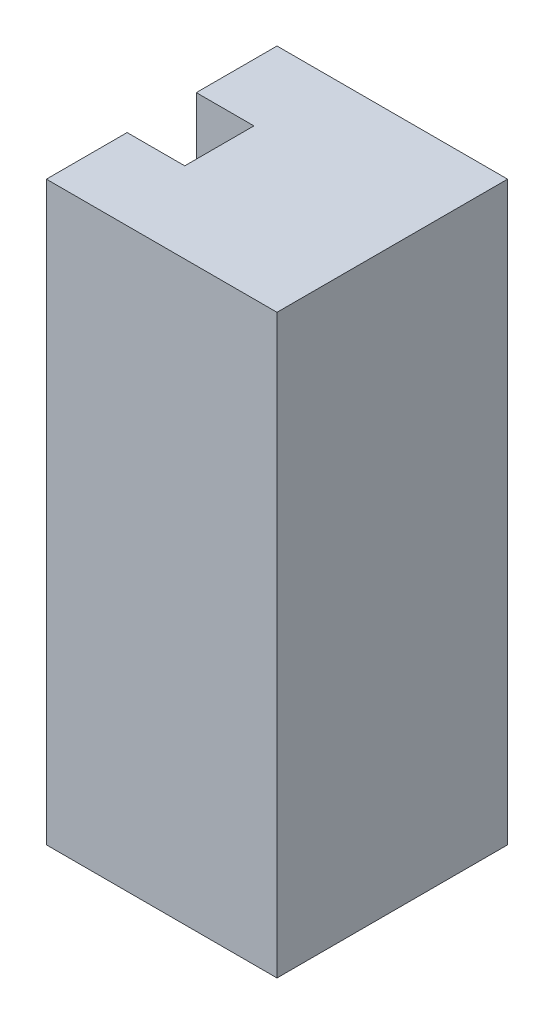
from build123d import *

# Parameters (mm, degrees)
SKETCH_1_W          = 20
SKETCH_1_H          = 20
EXTRUDE_1_DEPTH     = 50
SKETCH_2_W          = 6
SKETCH_2_H          = 50
CUT_EXTRUDE_1_DEPTH = 5


with BuildPart() as part:
    # 草图1 → 凸台-拉伸1 (new body)
    with BuildSketch(Plane(origin=(0, 0, 0), x_dir=(1, 0, 0), z_dir=(0, 1, 0))):
        with Locations((1.221122112, -6.138613861)):
            Rectangle(SKETCH_1_W, SKETCH_1_H)
    extrude(amount=EXTRUDE_1_DEPTH)

    # 草图2 → 切除-拉伸1 (cut)
    with BuildSketch(Plane.ZY.offset(8.778877888)):
        with Locations((6.138613861, 25)):
            Rectangle(SKETCH_2_W, SKETCH_2_H)
    extrude(amount=-CUT_EXTRUDE_1_DEPTH, mode=Mode.SUBTRACT)


solid = part.part
